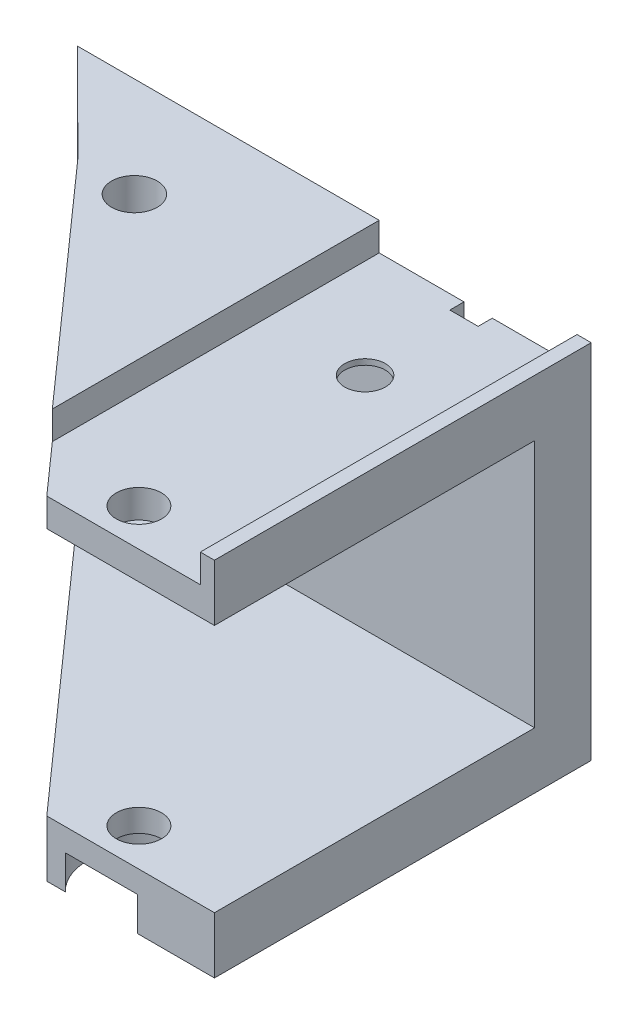
from build123d import *

# Parameters (mm, degrees)
SKETCH2_R               = 2.286
SKETCH2_R_2             = 2.54
BOSS_EXTRUDE1_DEPTH     = 6.35
SKETCH3_W               = 50.8
SKETCH3_H               = 27.94
BOSS_EXTRUDE2_DEPTH     = 6.35
SKETCH5_W               = 50.8
SKETCH5_H               = 6.35
BOSS_EXTRUDE3_DEPTH     = 6.35
CUT_EXTRUDE1_DEPTH      = 38.1
CUT_EXTRUDE1_DEPTH_BACK = 2.54
SKETCH6_R               = 6.35
BOSS_EXTRUDE4_START     = 6.35
SKETCH7_W               = 50.8
SKETCH7_H               = 6.35
SKETCH7_R               = 2.54
BOSS_EXTRUDE4_DEPTH     = 6.35
CUT_EXTRUDE2_DEPTH      = 3.175
SKETCH9_R               = 2.564291027
CUT_EXTRUDE3_DEPTH      = 127
SKETCH11_W              = 3.175
SKETCH11_H              = 37.465
CUT_EXTRUDE4_DEPTH      = 1.5875
SKETCH16_R              = 5.842
CUT_EXTRUDE7_DEPTH      = 3.81
SKETCH17_W              = 19.191430616
SKETCH17_H              = 21.182889484
CUT_EXTRUDE8_DEPTH      = 87.593141183
BOSS_EXTRUDE5_REACH     = 76.336


with BuildPart() as part:
    # Sketch2 → Boss-Extrude1 (new body)
    with BuildSketch(Plane(origin=(0, 0, 0), x_dir=(1, 0, 0), z_dir=(0, 1, 0))):
        Polygon((0, 0), (50.8, 0), (50.8, -57.15), align=None)
        with Locations(Location((38.1, -6.35, 0), (0, 0, 270))):
            Circle(SKETCH2_R, mode=Mode.SUBTRACT)
        with Locations(Location((38.1, -31.75, 0), (0, 0, 270))):
            Circle(SKETCH2_R_2, mode=Mode.SUBTRACT)
        with Locations(Location((10.699885901, -4.857157432, 0), (0, 0, 270))):
            Circle(SKETCH2_R_2, mode=Mode.SUBTRACT)
    extrude(amount=BOSS_EXTRUDE1_DEPTH)



with BuildPart() as body_2:
    # Sketch3 → Boss-Extrude2 (new body)
    with BuildSketch(Plane(origin=(0, 0, 0), x_dir=(-1, 0, 0), z_dir=(0, 0, -1))):
        with Locations((-25.4, -13.97)):
            Rectangle(SKETCH3_W, SKETCH3_H)
    extrude(amount=BOSS_EXTRUDE2_DEPTH)


with BuildPart() as part_1:
    add(part.part)

    add(body_2.part)  # Boss-Extrude3 merges body 2
    # Sketch5 → Boss-Extrude3 (add)
    with BuildSketch(Plane(origin=(0, 6.35, 0), x_dir=(1, 0, 0), z_dir=(0, 1, 0))):
        with Locations((25.4, 3.175)):
            Rectangle(SKETCH5_W, SKETCH5_H)
    extrude(amount=-BOSS_EXTRUDE3_DEPTH)

    # Sketch6 → Cut-Extrude1 (cut, two sides: drawn at the far end of the back side and taken through both)
    with BuildSketch(Plane.XZ.offset(-CUT_EXTRUDE1_DEPTH_BACK)):
        with Locations(Location((38.1, 6.35, 0), (0, 0, 270))):
            Circle(SKETCH6_R)
    extrude(amount=CUT_EXTRUDE1_DEPTH + CUT_EXTRUDE1_DEPTH_BACK, mode=Mode.SUBTRACT)

    # Sketch7 → Boss-Extrude4 (add)
    # profile 1 of 2: a face of its own
    with BuildSketch(Plane.XZ.offset(27.94).offset(BOSS_EXTRUDE4_START)):
        with Locations((25.4, -3.175)):
            Rectangle(SKETCH7_W, SKETCH7_H)
    # profile 2 of 2: a face of its own
    with BuildSketch(Plane.XZ.offset(27.94).offset(BOSS_EXTRUDE4_START)):
        Polygon((50.8, 57.15), (0, 0), (50.8, 0), align=None)
        with Locations(Location((38.1, 31.75, 0), (0, 0, 90))):
            Circle(SKETCH7_R, mode=Mode.SUBTRACT)
    extrude(amount=-BOSS_EXTRUDE4_DEPTH)

    # Sketch8 → Cut-Extrude2 (cut)
    with BuildSketch(Plane(origin=(0, 6.35, 0), x_dir=(1, 0, 0), z_dir=(0, 1, 0))):
        Polygon((26.9875, 6.35), (49.2125, 6.35), (49.2125, -55.3640625), (26.9875, -30.3609375), align=None)
    extrude(amount=-CUT_EXTRUDE2_DEPTH, mode=Mode.SUBTRACT)

    # Sketch9 → Cut-Extrude3 (cut)
    with BuildSketch(Plane(origin=(0, 6.35, 0), x_dir=(1, 0, 0), z_dir=(0, 1, 0))):
        with Locations(Location((10.699885901, -4.857157432, 0), (0, 0, 90))):
            Circle(SKETCH9_R)
    extrude(amount=-CUT_EXTRUDE3_DEPTH, mode=Mode.SUBTRACT)

    # Sketch11 → Cut-Extrude4 (cut)
    with BuildSketch(Plane(origin=(0, 0, -6.35), x_dir=(-1, 0, 0), z_dir=(0, 0, -1))):
        with Locations((-38.1, -15.5575)):
            Rectangle(SKETCH11_W, SKETCH11_H)
    extrude(amount=-CUT_EXTRUDE4_DEPTH, mode=Mode.SUBTRACT)

    # Sketch16 → Cut-Extrude7 (cut)
    with BuildSketch(Plane.XZ.offset(34.29)):
        with Locations(Location((38.1, 31.75, 0), (0, 0, 270))):
            Circle(SKETCH16_R)
    extrude(amount=-CUT_EXTRUDE7_DEPTH, mode=Mode.SUBTRACT)

    # Sketch17 → Cut-Extrude8 (cut, through all)
    with BuildSketch(Plane(origin=(0, 6.35, 0), x_dir=(1, 0, 0), z_dir=(0, 1, 0))):
        with Locations((41.204284692, -46.558555258)):
            Rectangle(SKETCH17_W, SKETCH17_H)
        Polygon((3.992356435, -4.491400989), (14.833757424, 6.35), (0, 6.35), (0, 0), align=None)
    extrude(amount=-CUT_EXTRUDE8_DEPTH, mode=Mode.SUBTRACT)

    # Boss-Extrude5: up to this face of the body (flat: up to its plane)
    boss_extrude5_end = Plane(part_1.part.faces().sort_by_distance((32.258274594, -34.29, 11.14322166))[0])
    # Sketch18 → Boss-Extrude5 (add, up to the picked face)
    with BuildSketch(Plane(origin=(0, 6.35, 0), x_dir=(1, 0, 0), z_dir=(0, 1, 0)), mode=Mode.PRIVATE) as boss_extrude5_sk1:
        Polygon((14.833757424, 6.35), (-6.915485897, 6.35), (3.992356435, -4.491400989), align=None)
    boss_extrude5_tool1 = split(extrude(boss_extrude5_sk1.sketch, amount=-BOSS_EXTRUDE5_REACH, mode=Mode.PRIVATE), bisect_by=boss_extrude5_end, keep=Keep.BOTH, mode=Mode.PRIVATE)
    add(boss_extrude5_tool1.solids().sort_by(Axis((3.970209, 6.35, -2.7362), (0, -1, 0)))[0])


solid = part_1.part
